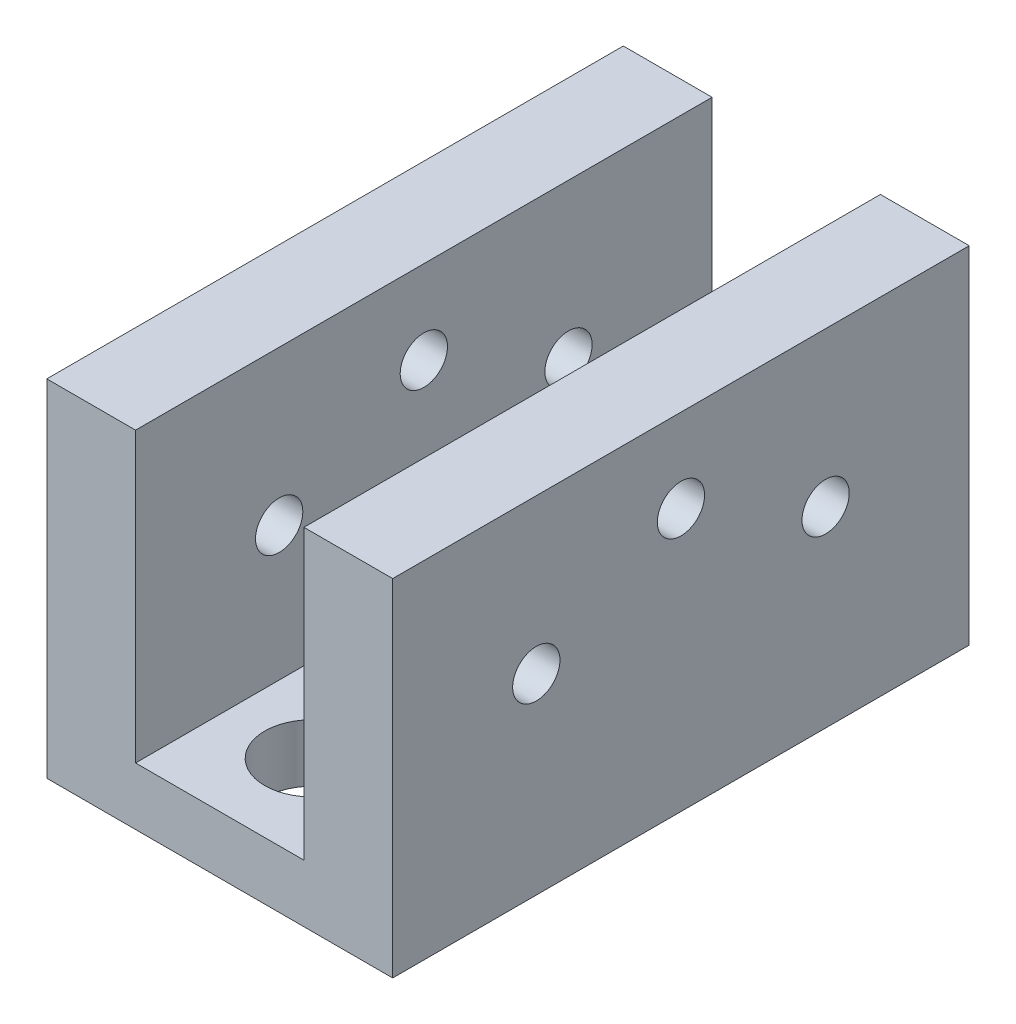
from build123d import *

# Parameters (mm, degrees)
SKETCH1_W           = 30
SKETCH1_H           = 50
SKETCH1_R           = 4.1
BOSS_EXTRUDE1_DEPTH = 5
BOSS_EXTRUDE2_DEPTH = 25
SKETCH4_R           = 2.05
CUT_EXTRUDE1_DEPTH  = 50.244289009
SKETCH5_W           = 14.6
SKETCH5_H           = 50
CUT_EXTRUDE2_DEPTH  = 25


with BuildPart() as part:
    # Sketch1 → Boss-Extrude1 (new body)
    with BuildSketch(Plane(origin=(0, 0, 0), x_dir=(1, 0, 0), z_dir=(0, 1, 0))):
        Rectangle(SKETCH1_W, SKETCH1_H)
        with Locations(Location((0, 17, 0), (0, 0, 270))):
            Circle(SKETCH1_R, mode=Mode.SUBTRACT)
        with Locations(Location((0, -17, 0), (0, 0, 270))):
            Circle(SKETCH1_R, mode=Mode.SUBTRACT)
    extrude(amount=BOSS_EXTRUDE1_DEPTH)

    # Sketch2 → Boss-Extrude2 (add)
    with BuildSketch(Plane(origin=(0, 5, 0), x_dir=(1, 0, 0), z_dir=(0, 1, 0))):
        Polygon((-7.25, -9.75), (7.25, -9.75), (7.25, -25), (15, -25), (15, 25), (7.25, 25), (7.25, 9.75), (-7.25, 9.75), (-7.25, 25), (-15, 25), (-15, -25), (-7.25, -25), align=None)
    extrude(amount=BOSS_EXTRUDE2_DEPTH)

    # Sketch4 → Cut-Extrude1 (cut, through all)
    with BuildSketch(Plane(origin=(15, 0, 0), x_dir=(0, 0, -1), z_dir=(1, 0, 0))):
        with Locations((-12.54526483, 16.63)):
            Circle(SKETCH4_R)
        with Locations((12.54526483, 16.63)):
            Circle(SKETCH4_R)
        with Locations((0, 22.755)):
            Circle(SKETCH4_R)
    extrude(amount=-CUT_EXTRUDE1_DEPTH, mode=Mode.SUBTRACT)

    # Sketch5 → Cut-Extrude2 (cut)
    with BuildSketch(Plane(origin=(0, 30, 0), x_dir=(1, 0, 0), z_dir=(0, 1, 0))):
        Rectangle(SKETCH5_W, SKETCH5_H)
    extrude(amount=-CUT_EXTRUDE2_DEPTH, mode=Mode.SUBTRACT)


solid = part.part
